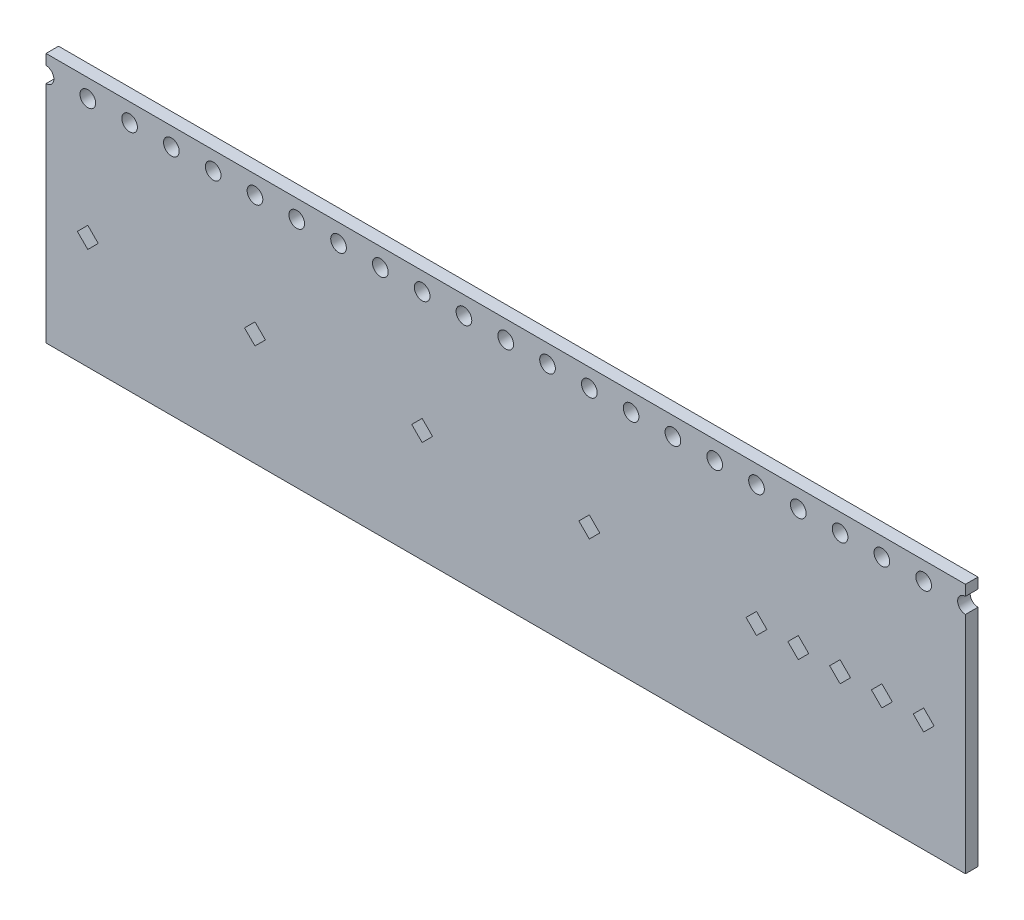
from build123d import *

# Parameters (mm, degrees)
TOP_SKETCH_W                   = 88
TOP_SKETCH_H                   = 24
THICKNESS_EXTRUDE_DEPTH        = 1.2
PIN_HOLE_SKETCH_R              = 0.75
FIRST_PIN_HOLE_CUT_DEPTH       = 92.221927189
PIN_HOLE_PATTERN_COUNT         = 23
PIN_HOLE_PATTERN_PITCH         = 4
MARKER_CUT_DEPTH               = 92.221927189
COMPONENT_MARKER_PATTERN_COUNT = 4
COMPONENT_MARKER_PATTERN_PITCH = 4
PIN_HOLE_MARKER_PATTERN_COUNT  = 6
PIN_HOLE_MARKER_PATTERN_PITCH  = 16


with BuildPart() as part:
    # Top Sketch → Thickness Extrude (new body)
    with BuildSketch(Plane.XY):
        with Locations((-44, -12)):
            Rectangle(TOP_SKETCH_W, TOP_SKETCH_H)
    extrude(amount=-THICKNESS_EXTRUDE_DEPTH)

    # Pin Hole Sketch → First Pin Hole Cut (cut, through all)
    with BuildSketch(Plane.XY):
        with Locations((0, -1.75)):
            Circle(PIN_HOLE_SKETCH_R)
    first_pin_hole_cut = extrude(amount=-FIRST_PIN_HOLE_CUT_DEPTH, mode=Mode.SUBTRACT)

    # Pin Hole Pattern: First Pin Hole Cut ×23
    with Locations(*[(-i * PIN_HOLE_PATTERN_PITCH, 0, 0) for i in range(1, PIN_HOLE_PATTERN_COUNT)]):
        add(first_pin_hole_cut, mode=Mode.SUBTRACT)

    # Marker Sketch → Marker Cut (cut, through all)
    with BuildSketch(Plane.XY):
        Polygon((-4, -12.25), (-5, -13.25), (-4, -14.25), (-3, -13.25), align=None)
    marker_cut = extrude(amount=-MARKER_CUT_DEPTH, mode=Mode.SUBTRACT)

    # Component Marker Pattern: Marker Cut ×4
    with Locations(*[(-i * COMPONENT_MARKER_PATTERN_PITCH, 0, 0) for i in range(1, COMPONENT_MARKER_PATTERN_COUNT)]):
        add(marker_cut, mode=Mode.SUBTRACT)

    # Pin Hole Marker Pattern: Marker Cut ×6
    with Locations(*[(-i * PIN_HOLE_MARKER_PATTERN_PITCH, 0, 0) for i in range(1, PIN_HOLE_MARKER_PATTERN_COUNT)]):
        add(marker_cut, mode=Mode.SUBTRACT)


solid = part.part
